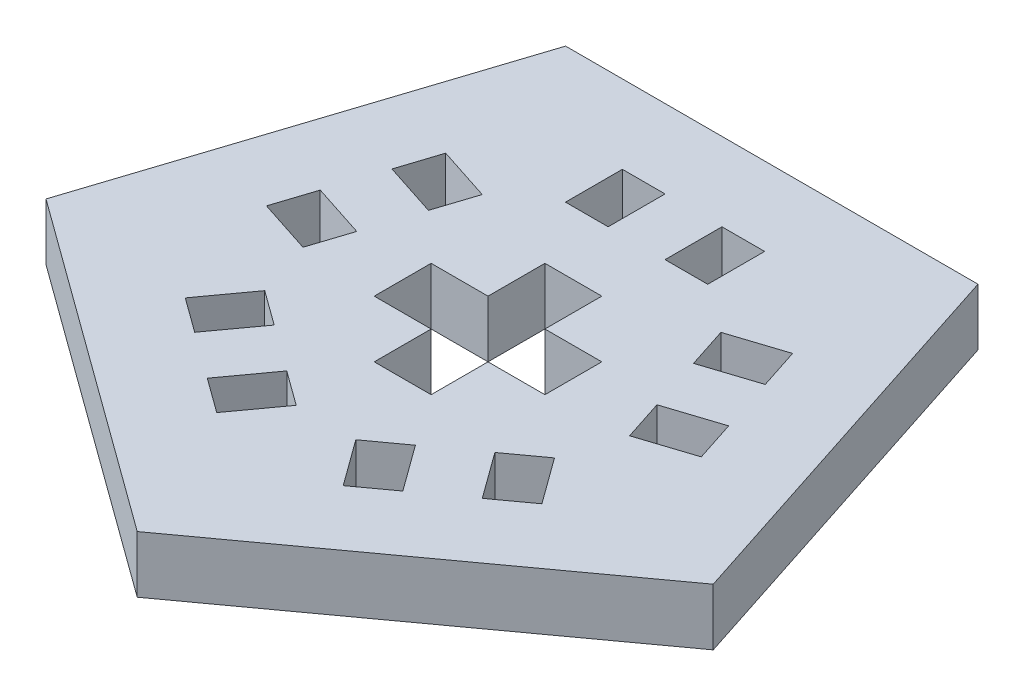
from build123d import *

# Parameters (mm, degrees)
SKETCH1_W           = 3.81
SKETCH1_H           = 5.08
BOSS_EXTRUDE1_DEPTH = 5.08
CUT_EXTRUDE1_DEPTH  = 5.08


with BuildPart() as part:
    # Sketch1 → Boss-Extrude1 (new body)
    with BuildSketch(Plane(origin=(0, 0, 0), x_dir=(1, 0, 0), z_dir=(0, 1, 0))):
        Polygon((-2.995905159, -37.721169498), (26.791971131, -16.079010555), (15.414014841, 18.938738206), (-21.405825159, 18.938738206), (-32.783781449, -16.079010555), align=None)
        Polygon((15.238089821, -3.146472779), (16.415444569, -6.769998106), (11.584077466, -8.339804437), (10.406722718, -4.71627911), align=None, mode=Mode.SUBTRACT)
        with Locations((1.449094841, 9.40671805)):
            Rectangle(SKETCH1_W, SKETCH1_H, mode=Mode.SUBTRACT)
        with Locations((-7.440905159, 9.40671805)):
            Rectangle(SKETCH1_W, SKETCH1_H, mode=Mode.SUBTRACT)
        Polygon((13.668283489, 1.684894324), (12.490928741, 5.308419651), (7.659561638, 3.73861332), (8.836916386, 0.115087993), align=None, mode=Mode.SUBTRACT)
        Polygon((5.733323489, -22.736401436), (2.650968741, -24.975863247), (-0.334980341, -20.866056916), (2.747374408, -18.626595105), align=None, mode=Mode.SUBTRACT)
        Polygon((9.843129821, -19.750452355), (12.925484569, -17.510990543), (9.939535488, -13.401184212), (6.857180739, -15.640646023), align=None, mode=Mode.SUBTRACT)
        Polygon((-15.834940138, -19.750452355), (-18.917294887, -17.510990543), (-15.931345805, -13.401184212), (-12.848991056, -15.640646023), align=None, mode=Mode.SUBTRACT)
        Polygon((-11.725133807, -22.736401436), (-8.642779058, -24.975863247), (-5.656829976, -20.866056916), (-8.739184725, -18.626595105), align=None, mode=Mode.SUBTRACT)
        Polygon((-19.660093807, 1.684894324), (-18.482739058, 5.308419651), (-13.651371955, 3.73861332), (-14.828726704, 0.115087993), align=None, mode=Mode.SUBTRACT)
        Polygon((-21.229900138, -3.146472779), (-22.407254887, -6.769998106), (-17.575887784, -8.339804437), (-16.398533035, -4.71627911), align=None, mode=Mode.SUBTRACT)
    extrude(amount=BOSS_EXTRUDE1_DEPTH)

    # Sketch2 → Cut-Extrude1 (cut)
    with BuildSketch(Plane(origin=(0, 5.08, 0), x_dir=(1, 0, 0), z_dir=(0, 1, 0))):
        Polygon((-2.995905159, 1.219657161), (-0.455905159, 1.219657161), (-0.455905159, -3.860342839), (4.624094841, -3.860342839), (4.624094841, -6.400342839), (4.624094841, -8.940342839), (-0.455905159, -8.940342839), (-0.455905159, -14.020342839), (-2.995905159, -14.020342839), (-5.535905159, -14.020342839), (-5.535905159, -8.940342839), (-10.615905159, -8.940342839), (-10.615905159, -6.400342839), (-10.615905159, -3.860342839), (-5.535905159, -3.860342839), (-5.535905159, 1.219657161), align=None)
    extrude(amount=-CUT_EXTRUDE1_DEPTH, mode=Mode.SUBTRACT)


solid = part.part
